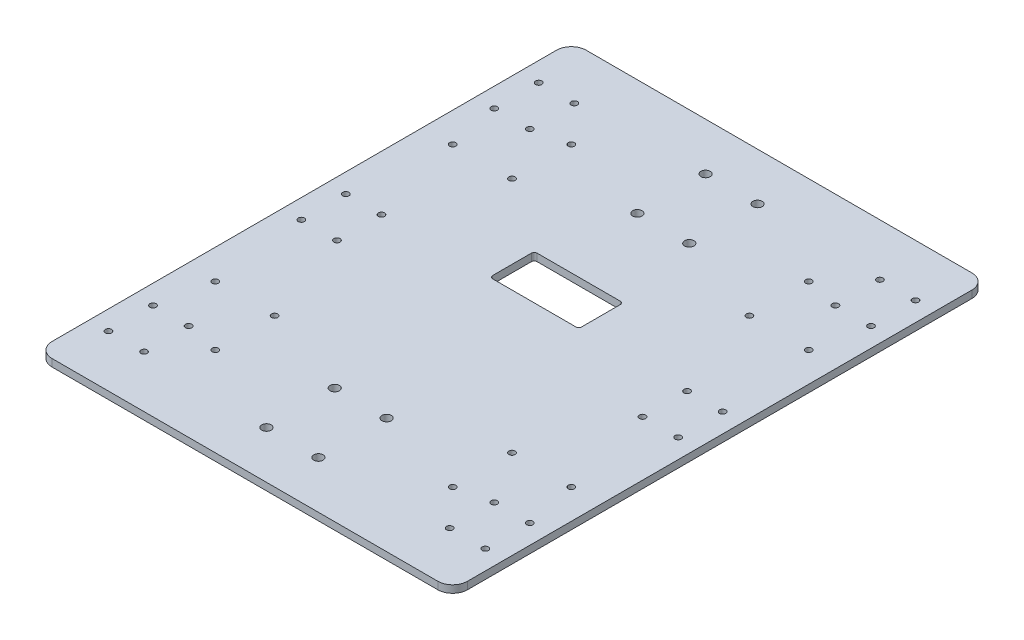
from build123d import *

# Parameters (mm, degrees)
SKETCH_1_R           = 2.1
SKETCH_1_R_2         = 3.15
EXTRUDE_1_DEPTH      = 5
SKETCH_2_OUTSIDE_W   = 463.828
SKETCH_2_OUTSIDE_H   = 463.828
SKETCH_2_OUTSIDE_W_2 = 280
SKETCH_2_OUTSIDE_H_2 = 360
CUT_EXTRUDE_2_DEPTH  = 10
SKETCH_3_R           = 2.1
CUT_EXTRUDE_3_DEPTH  = 229.089894559
CUT_EXTRUDE_5_DEPTH  = 10
FILLET_1_R           = 10


with BuildPart() as part:
    # 草图1 → 凸台-拉伸1 (new body)
    with BuildSketch(Plane(origin=(0, 0, 0), x_dir=(1, 0, 0), z_dir=(0, 1, 0))):
        Polygon((-180, -180), (180, -180), (180, -160), (141, -160), (141, -100), (180, -100), (180, -30), (141, -30), (141, 30), (180, 30), (180, 100), (141, 100), (141, 160), (180, 160), (180, 180), (-180, 180), (-180, 160), (-141, 160), (-141, 100), (-180, 100), (-180, 30), (-141, 30), (-141, -30), (-180, -30), (-180, -100), (-141, -100), (-141, -160), (-180, -160), align=None)
        with Locations(Location((-103, 145, 0), (0, 0, 270))):
            Circle(SKETCH_1_R, mode=Mode.SUBTRACT)
        with Locations(Location((-103, 115, 0), (0, 0, 90))):
            Circle(SKETCH_1_R, mode=Mode.SUBTRACT)
        with Locations(Location((-127, 145, 0), (0, 0, 90))):
            Circle(SKETCH_1_R, mode=Mode.SUBTRACT)
        with Locations(Location((-127, 115, 0), (0, 0, 270))):
            Circle(SKETCH_1_R, mode=Mode.SUBTRACT)
        with Locations(Location((103, 145, 0), (0, 0, 270))):
            Circle(SKETCH_1_R, mode=Mode.SUBTRACT)
        with Locations(Location((103, 115, 0), (0, 0, 90))):
            Circle(SKETCH_1_R, mode=Mode.SUBTRACT)
        with Locations(Location((127, 145, 0), (0, 0, 90))):
            Circle(SKETCH_1_R, mode=Mode.SUBTRACT)
        with Locations(Location((127, 115, 0), (0, 0, 270))):
            Circle(SKETCH_1_R, mode=Mode.SUBTRACT)
        with Locations(Location((127, -115, 0), (0, 0, 270))):
            Circle(SKETCH_1_R, mode=Mode.SUBTRACT)
        with Locations(Location((127, -145, 0), (0, 0, 90))):
            Circle(SKETCH_1_R, mode=Mode.SUBTRACT)
        with Locations(Location((103, -145, 0), (0, 0, 270))):
            Circle(SKETCH_1_R, mode=Mode.SUBTRACT)
        with Locations(Location((103, -115, 0), (0, 0, 90))):
            Circle(SKETCH_1_R, mode=Mode.SUBTRACT)
        with Locations(Location((-127, -115, 0), (0, 0, 270))):
            Circle(SKETCH_1_R, mode=Mode.SUBTRACT)
        with Locations(Location((-103, -115, 0), (0, 0, 90))):
            Circle(SKETCH_1_R, mode=Mode.SUBTRACT)
        with Locations(Location((-103, -145, 0), (0, 0, 270))):
            Circle(SKETCH_1_R, mode=Mode.SUBTRACT)
        with Locations(Location((-127, -145, 0), (0, 0, 90))):
            Circle(SKETCH_1_R, mode=Mode.SUBTRACT)
        with Locations(Location((17.5, -102, 0), (0, 0, 270))):
            Circle(SKETCH_1_R_2, mode=Mode.SUBTRACT)
        with Locations(Location((-17.5, -102, 0), (0, 0, 90))):
            Circle(SKETCH_1_R_2, mode=Mode.SUBTRACT)
        with Locations(Location((-17.5, -148, 0), (0, 0, 270))):
            Circle(SKETCH_1_R_2, mode=Mode.SUBTRACT)
        with Locations(Location((17.5, -148, 0), (0, 0, 90))):
            Circle(SKETCH_1_R_2, mode=Mode.SUBTRACT)
        with Locations(Location((-17.5, 148, 0), (0, 0, 270))):
            Circle(SKETCH_1_R_2, mode=Mode.SUBTRACT)
        with Locations(Location((17.5, 148, 0), (0, 0, 90))):
            Circle(SKETCH_1_R_2, mode=Mode.SUBTRACT)
        with Locations(Location((17.5, 102, 0), (0, 0, 270))):
            Circle(SKETCH_1_R_2, mode=Mode.SUBTRACT)
        with Locations(Location((-17.5, 102, 0), (0, 0, 90))):
            Circle(SKETCH_1_R_2, mode=Mode.SUBTRACT)
        with Locations(Location((-103, 15, 0), (0, 0, 270))):
            Circle(SKETCH_1_R, mode=Mode.SUBTRACT)
        with Locations(Location((-103, -15, 0), (0, 0, 90))):
            Circle(SKETCH_1_R, mode=Mode.SUBTRACT)
        with Locations(Location((-127, 15, 0), (0, 0, 90))):
            Circle(SKETCH_1_R, mode=Mode.SUBTRACT)
        with Locations(Location((-127, -15, 0), (0, 0, 270))):
            Circle(SKETCH_1_R, mode=Mode.SUBTRACT)
        with Locations(Location((127, 15, 0), (0, 0, 270))):
            Circle(SKETCH_1_R, mode=Mode.SUBTRACT)
        with Locations(Location((127, -15, 0), (0, 0, 90))):
            Circle(SKETCH_1_R, mode=Mode.SUBTRACT)
        with Locations(Location((103, 15, 0), (0, 0, 90))):
            Circle(SKETCH_1_R, mode=Mode.SUBTRACT)
        with Locations(Location((103, -15, 0), (0, 0, 270))):
            Circle(SKETCH_1_R, mode=Mode.SUBTRACT)
    extrude(amount=EXTRUDE_1_DEPTH)

    # 草图2 outside → 切除-拉伸2 (cut)
    with BuildSketch(Plane(origin=(0, 5, 0), x_dir=(1, 0, 0), z_dir=(0, 1, 0))):
        Rectangle(SKETCH_2_OUTSIDE_W, SKETCH_2_OUTSIDE_H)
        Rectangle(SKETCH_2_OUTSIDE_W_2, SKETCH_2_OUTSIDE_H_2, mode=Mode.SUBTRACT)
    extrude(amount=-CUT_EXTRUDE_2_DEPTH, mode=Mode.SUBTRACT)

    # 草图3 → 切除-拉伸3 (cut, through all)
    with BuildSketch(Plane(origin=(0, 5, 0), x_dir=(1, 0, 0), z_dir=(0, 1, 0))):
        with Locations(Location((-80, 80, 0), (0, 0, 270))):
            Circle(SKETCH_3_R)
        with Locations(Location((-120, 80, 0), (0, 0, 270))):
            Circle(SKETCH_3_R)
        with Locations(Location((-80, 120, 0), (0, 0, 270))):
            Circle(SKETCH_3_R)
        with Locations(Location((-80, -120, 0), (0, 0, 90))):
            Circle(SKETCH_3_R)
        with Locations(Location((-120, -80, 0), (0, 0, 90))):
            Circle(SKETCH_3_R)
        with Locations(Location((-80, -80, 0), (0, 0, 90))):
            Circle(SKETCH_3_R)
        with Locations(Location((80, -80, 0), (0, 0, 270))):
            Circle(SKETCH_3_R)
        with Locations(Location((120, -80, 0), (0, 0, 270))):
            Circle(SKETCH_3_R)
        with Locations(Location((80, -120, 0), (0, 0, 270))):
            Circle(SKETCH_3_R)
        with Locations(Location((80, 120, 0), (0, 0, 90))):
            Circle(SKETCH_3_R)
        with Locations(Location((120, 80, 0), (0, 0, 90))):
            Circle(SKETCH_3_R)
        with Locations(Location((80, 80, 0), (0, 0, 90))):
            Circle(SKETCH_3_R)
    extrude(amount=-CUT_EXTRUDE_3_DEPTH, mode=Mode.SUBTRACT)

    # 草图5 → 切除-拉伸5 (cut)
    with BuildSketch(Plane.XZ):
        with BuildLine():
            Line((-28, -45), (28, -45))
            ThreePointArc((28, -45), (29.414213562, -44.414213562), (30, -43))
            Line((30, -43), (30, -17))
            ThreePointArc((30, -17), (29.414213562, -15.585786438), (28, -15))
            Line((28, -15), (-28, -15))
            ThreePointArc((-28, -15), (-29.414213562, -15.585786438), (-30, -17))
            Line((-30, -17), (-30, -43))
            ThreePointArc((-30, -43), (-29.414213562, -44.414213562), (-28, -45))
        make_face()
    extrude(amount=-CUT_EXTRUDE_5_DEPTH, mode=Mode.SUBTRACT)

    # 圆角1
    fillet_1_edges = [part.edges().sort_by_distance(p)[0] for p in [
        (-140, 2.5, 180),
        (140, 2.5, 180),
        (-140, 2.5, -180),
        (140, 2.5, -180),
    ]]
    fillet(fillet_1_edges, radius=FILLET_1_R)


solid = part.part
